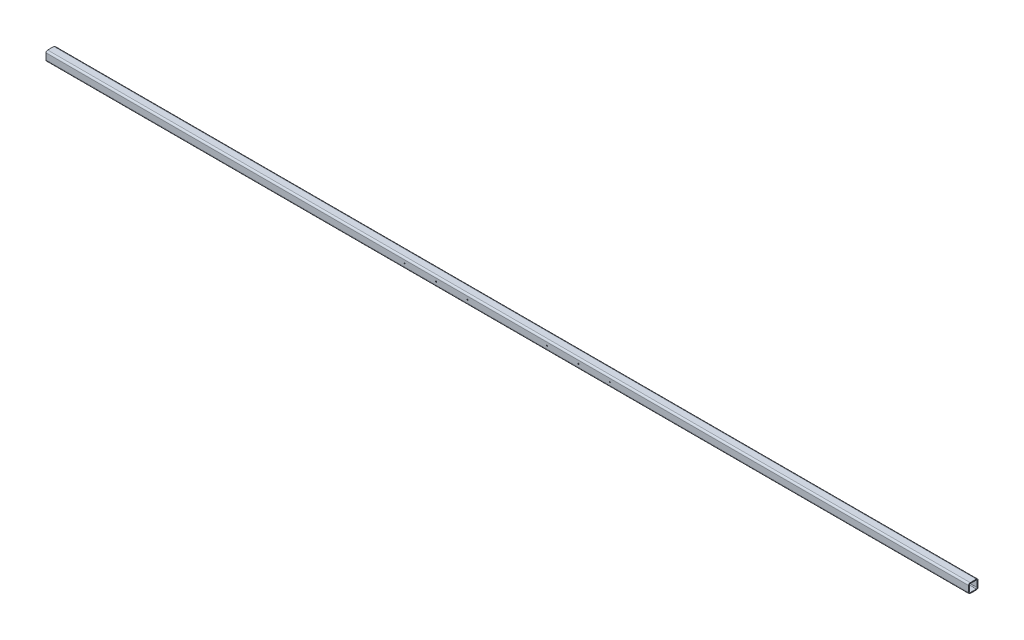
from build123d import *

# Parameters (mm, degrees)
MEMBER_1_DEPTH         = 2932
HOLE_WIZARD_M4_1_D     = 3.3
HOLE_WIZARD_M4_1_DEPTH = 10.1
HOLE_WIZARD_M4_1_TIP   = 0.991420021
HOLE_WIZARD_M4_2_D     = 3.3
HOLE_WIZARD_M4_2_DEPTH = 10.1
HOLE_WIZARD_M4_2_TIP   = 0.991420021


with BuildPart() as part:
    # Sketch1 → Member 1 (new body)
    with BuildSketch(Plane.YZ):
        with BuildLine():
            Line((-9.8, -15), (9.8, -15))
            ThreePointArc((9.8, -15), (13.476955262, -13.476955262), (15, -9.8))
            Line((15, -9.8), (15, 9.8))
            ThreePointArc((15, 9.8), (13.476955262, 13.476955262), (9.8, 15))
            Line((9.8, 15), (-9.8, 15))
            ThreePointArc((-9.8, 15), (-13.476955262, 13.476955262), (-15, 9.8))
            Line((-15, 9.8), (-15, -9.8))
            ThreePointArc((-15, -9.8), (-13.476955262, -13.476955262), (-9.8, -15))
        make_face()
        with BuildLine():
            Line((-9.8, -12.4), (9.8, -12.4))
            ThreePointArc((9.8, -12.4), (11.638477631, -11.638477631), (12.4, -9.8))
            Line((12.4, -9.8), (12.4, 9.8))
            ThreePointArc((12.4, 9.8), (11.638477631, 11.638477631), (9.8, 12.4))
            Line((9.8, 12.4), (-9.8, 12.4))
            ThreePointArc((-9.8, 12.4), (-11.638477631, 11.638477631), (-12.4, 9.8))
            Line((-12.4, 9.8), (-12.4, -9.8))
            ThreePointArc((-12.4, -9.8), (-11.638477631, -11.638477631), (-9.8, -12.4))
        make_face(mode=Mode.SUBTRACT)
    extrude(amount=MEMBER_1_DEPTH)

    # M4 螺纹孔1
    with Locations(Plane(origin=(0, -15, 0), x_dir=(-1, 0, 0), z_dir=(0, -1, 0))):
        with Locations((-20.95, 0), (-50.95, 0), (-2881.05, 0), (-2911.05, 0)):
            Hole(HOLE_WIZARD_M4_1_D / 2, depth=HOLE_WIZARD_M4_1_DEPTH)
            with Locations((0, 0, -(HOLE_WIZARD_M4_1_DEPTH + HOLE_WIZARD_M4_1_TIP / 2))):  # 118° drill point
                Cone(0, HOLE_WIZARD_M4_1_D / 2, HOLE_WIZARD_M4_1_TIP, mode=Mode.SUBTRACT)

    # M4 螺纹孔2
    with Locations(Plane.XY.offset(15)):
        with Locations((1139.95, 0), (1239.95, 0), (1339.95, 0), (1592.05, 0), (1692.05, 0), (1792.05, 0)):
            Hole(HOLE_WIZARD_M4_2_D / 2, depth=HOLE_WIZARD_M4_2_DEPTH)
            with Locations((0, 0, -(HOLE_WIZARD_M4_2_DEPTH + HOLE_WIZARD_M4_2_TIP / 2))):  # 118° drill point
                Cone(0, HOLE_WIZARD_M4_2_D / 2, HOLE_WIZARD_M4_2_TIP, mode=Mode.SUBTRACT)


solid = part.part
